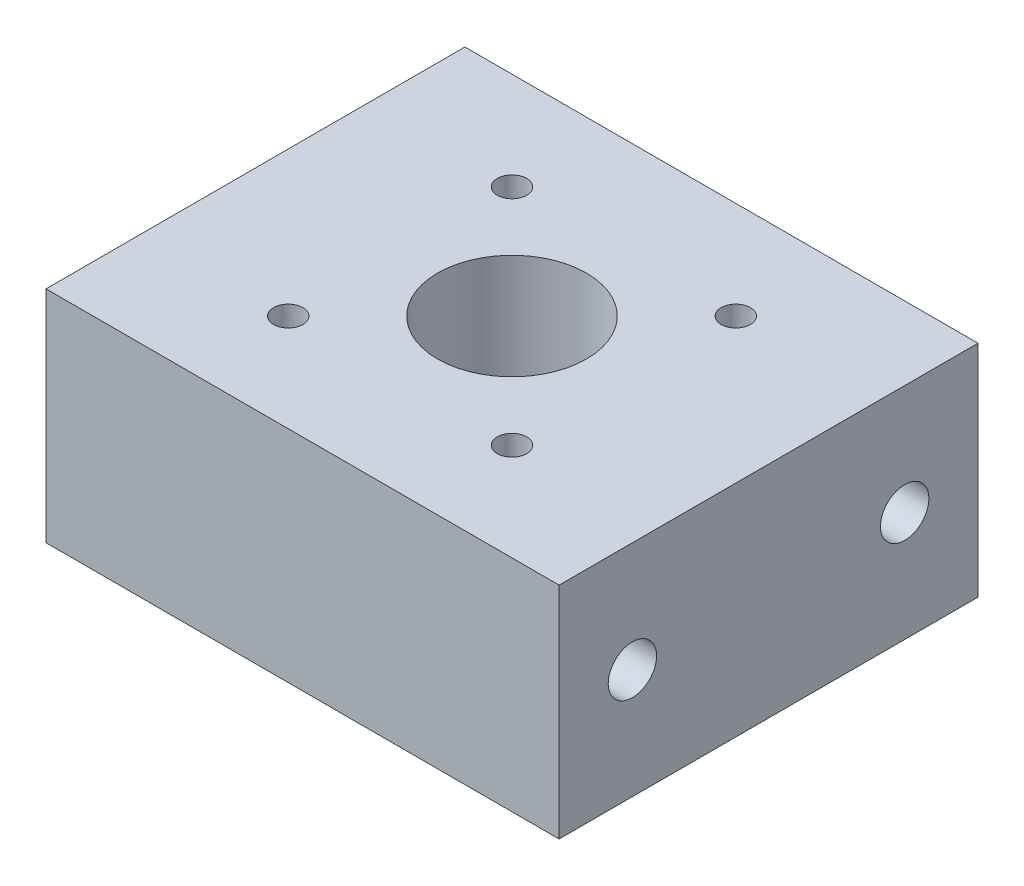
from build123d import *

# Parameters (mm, degrees)
SKETCH1_W             = 35
SKETCH1_H             = 28.575
BOSS_EXTRUDE1_DEPTH   = 15
SKETCH2_R             = 5.08
CUT_EXTRUDE2_DEPTH    = 30
SKETCH4_R             = 1
CUT_EXTRUDE3_DEPTH    = 15
M4X0_7_TAPPED_HOLE1_D = 3.3


with BuildPart() as part:
    # Sketch1 → Boss-Extrude1 (new body)
    with BuildSketch(Plane(origin=(0, 0, 0), x_dir=(1, 0, 0), z_dir=(0, 1, 0))):
        Rectangle(SKETCH1_W, SKETCH1_H)
    extrude(amount=-BOSS_EXTRUDE1_DEPTH)

    # Sketch2 → Cut-Extrude2 (cut)
    with BuildSketch(Plane(origin=(0, 0, 0), x_dir=(1, 0, 0), z_dir=(0, 1, 0))):
        Circle(SKETCH2_R)
    extrude(amount=-CUT_EXTRUDE2_DEPTH, mode=Mode.SUBTRACT)

    # Sketch4 → Cut-Extrude3 (cut)
    with BuildSketch(Plane(origin=(0, 0, 0), x_dir=(1, 0, 0), z_dir=(0, 1, 0))):
        with Locations((7.633, 7.633)):
            Circle(SKETCH4_R)
        with Locations((-7.633, 7.633)):
            Circle(SKETCH4_R)
        with Locations((-7.633, -7.633)):
            Circle(SKETCH4_R)
        with Locations((7.633, -7.633)):
            Circle(SKETCH4_R)
    extrude(amount=-CUT_EXTRUDE3_DEPTH, mode=Mode.SUBTRACT)

    # M4x0.7 Tapped Hole1 (through all)
    with Locations(Plane(origin=(-17.5, 0, 0), x_dir=(0, -1, 0), z_dir=(-1, 0, 0))):
        with Locations((7.5, -9.2875), (7.5, 9.2875)):
            Hole(M4X0_7_TAPPED_HOLE1_D / 2)


solid = part.part
